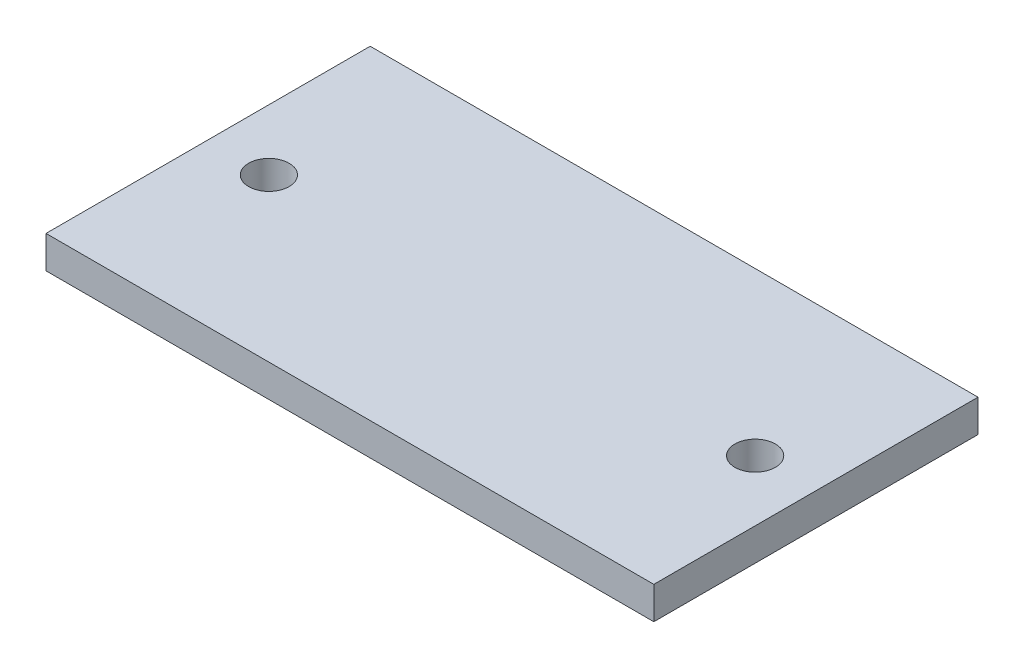
from build123d import *

# Parameters (mm, degrees)
SKETCH1_W           = 15
SKETCH1_H           = 8
BOSS_EXTRUDE1_DEPTH = 0.8
SKETCH4_R           = 0.5
CUT_EXTRUDE1_DEPTH  = 18.01881312


with BuildPart() as part:
    # Sketch1 → Boss-Extrude1 (new body)
    with BuildSketch(Plane(origin=(0, 0, 0), x_dir=(1, 0, 0), z_dir=(0, 1, 0))):
        with Locations((-7.5, 4)):
            Rectangle(SKETCH1_W, SKETCH1_H)
    extrude(amount=BOSS_EXTRUDE1_DEPTH)

    # Sketch4 → Cut-Extrude1 (cut, through all)
    with BuildSketch(Plane(origin=(0, 0.8, 0), x_dir=(1, 0, 0), z_dir=(0, 1, 0))):
        with Locations(Location((-13.5, 4, 0), (0, 0, 270))):
            Circle(SKETCH4_R)
        with Locations(Location((-1.5, 4, 0), (0, 0, 270))):
            Circle(SKETCH4_R)
    extrude(amount=-CUT_EXTRUDE1_DEPTH, mode=Mode.SUBTRACT)


solid = part.part
